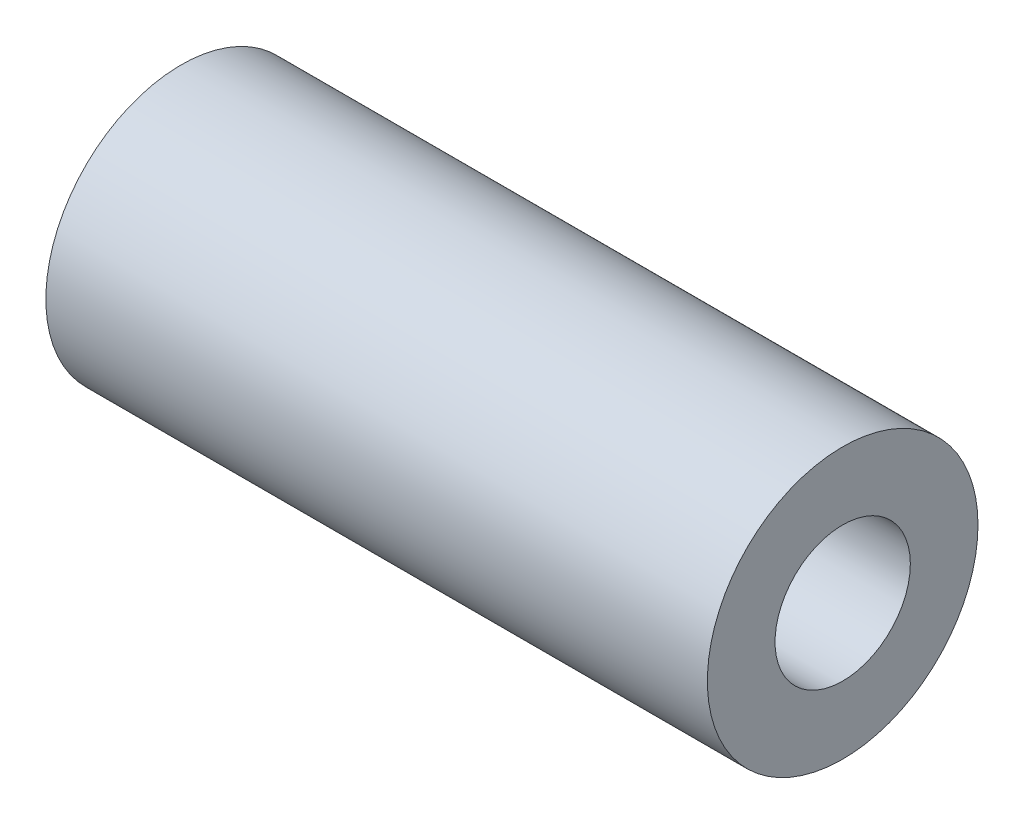
from build123d import *

# Parameters (mm, degrees)
CROQUIS1_R                   = 4.5
SALIENTE_EXTRUIR1_DEPTH      = 11
TALADRO_DE_MARGEN_PARA_M41_D = 4.5


with BuildPart() as part:
    # Croquis1 → Saliente-Extruir1 (new, symmetric)
    with BuildSketch(Plane(origin=(0, 0, 0), x_dir=(0, 0, -1), z_dir=(1, 0, 0))):
        Circle(CROQUIS1_R)
    extrude(amount=SALIENTE_EXTRUIR1_DEPTH, both=True)

    # Taladro de margen para M41 (through all)
    with Locations(Plane(origin=(11, 0, 0), x_dir=(0, 0, -1), z_dir=(1, 0, 0))):
        with Locations((0, 0)):
            Hole(TALADRO_DE_MARGEN_PARA_M41_D / 2)


solid = part.part
